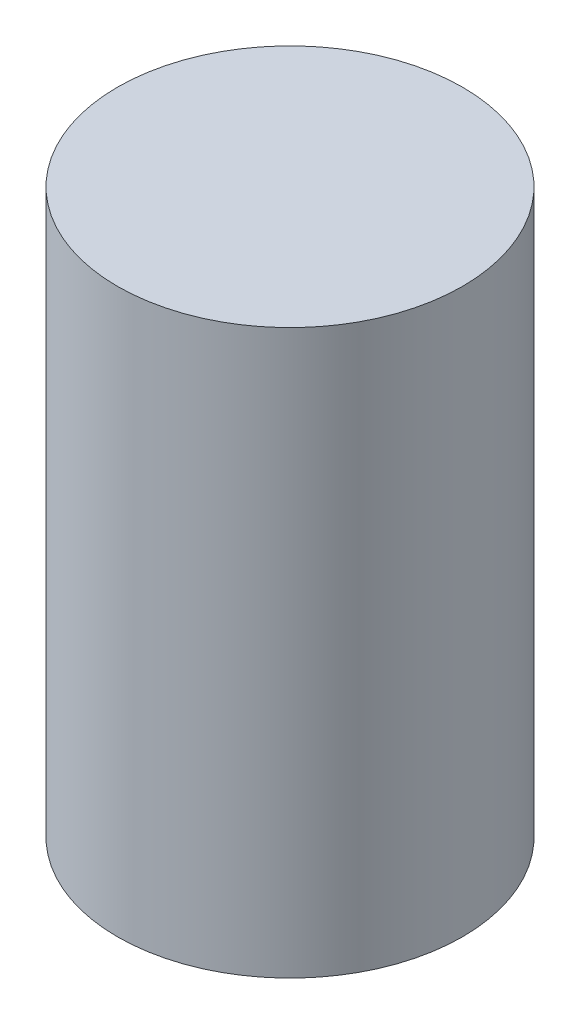
from build123d import *

# Parameters (mm, degrees)
SKETCH1_R           = 2.45
BOSS_EXTRUDE1_DEPTH = 8
SKETCH2_R           = 1.65
CUT_EXTRUDE1_DEPTH  = 7


with BuildPart() as part:
    # Sketch1 → Boss-Extrude1 (new body)
    with BuildSketch(Plane(origin=(0, 0, 0), x_dir=(1, 0, 0), z_dir=(0, 1, 0))):
        with Locations(Location((0, 0, 0), (0, 0, 270))):
            Circle(SKETCH1_R)
    extrude(amount=BOSS_EXTRUDE1_DEPTH)

    # Sketch2 → Cut-Extrude1 (cut)
    with BuildSketch(Plane.XZ):
        with Locations(Location((0, 0, 0), (0, 0, 270))):
            Circle(SKETCH2_R)
    extrude(amount=-CUT_EXTRUDE1_DEPTH, mode=Mode.SUBTRACT)


solid = part.part
